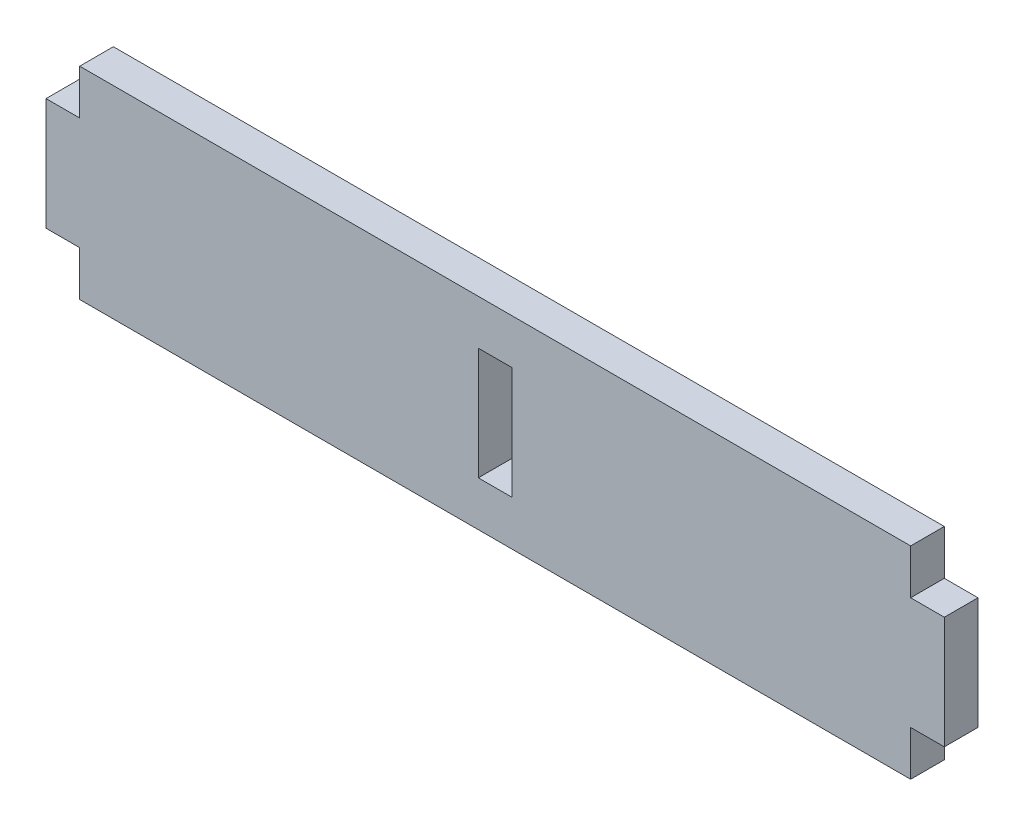
from build123d import *

# Parameters (mm, degrees)
SKETCH_1_W          = 3
SKETCH_1_H          = 10
SKETCH_1_W_2        = 74
SKETCH_1_H_2        = 18
EXTRUDE_1_DEPTH     = 3
SKETCH_2_W          = 3
SKETCH_2_H          = 10
CUT_EXTRUDE_1_DEPTH = 3


with BuildPart() as part:
    # 草圖1 → 填料-伸長1 (new body)
    with BuildSketch(Plane.XY):
        with Locations((-38.5, 0)):
            Rectangle(SKETCH_1_W, SKETCH_1_H)
        Rectangle(SKETCH_1_W_2, SKETCH_1_H_2)
        with Locations((38.5, 0)):
            Rectangle(SKETCH_1_W, SKETCH_1_H)
    extrude(amount=EXTRUDE_1_DEPTH)

    # 草圖2 → 除料-伸長1 (cut)
    with BuildSketch(Plane.XY.offset(3)):
        Rectangle(SKETCH_2_W, SKETCH_2_H)
    extrude(amount=-CUT_EXTRUDE_1_DEPTH, mode=Mode.SUBTRACT)


solid = part.part
